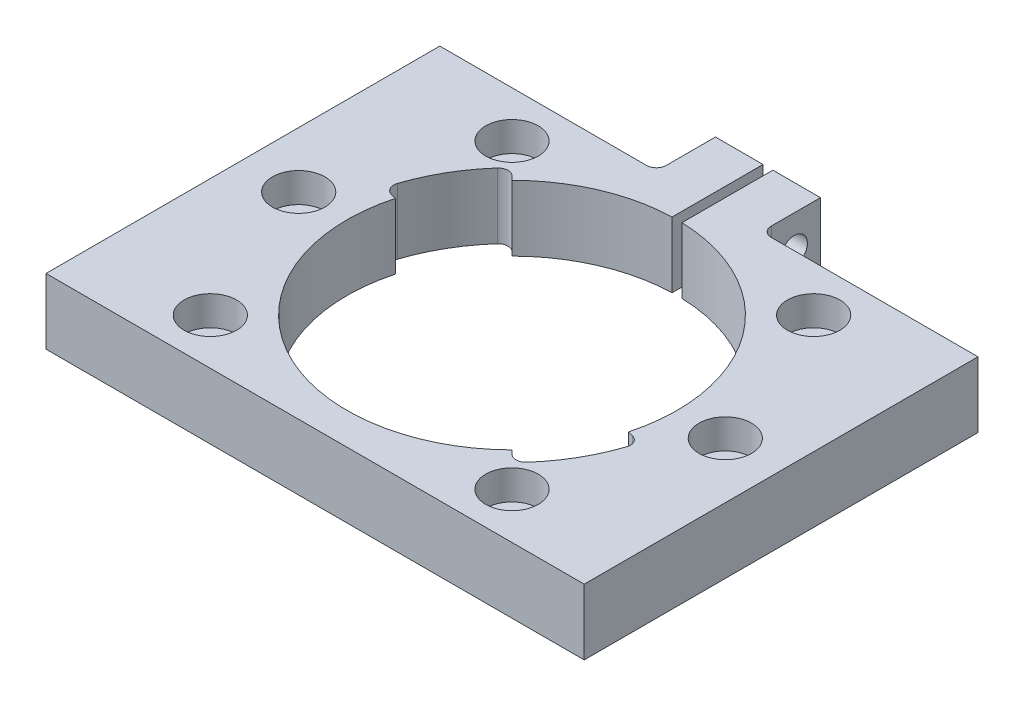
from build123d import *

# Parameters (mm, degrees)
SKETCH1_W           = 82
SKETCH1_H           = 60
SKETCH1_R           = 1.999999999
SKETCH1_R_2         = 2.000000001
SKETCH1_R_3         = 1.999999998
SKETCH1_R_4         = 2.000000002
BOSS_EXTRUDE1_DEPTH = 10
SKETCH2_W           = 16
SKETCH2_H           = 9
BOSS_EXTRUDE2_DEPTH = 10
SKETCH3_W           = 1.5
SKETCH3_H           = 14
CUT_EXTRUDE1_DEPTH  = 10
SKETCH4_R           = 2
CUT_EXTRUDE2_DEPTH  = 7.25
SKETCH5_R           = 1.6
CUT_EXTRUDE3_DEPTH  = 10
SKETCH7_R           = 4.000000002
SKETCH7_R_2         = 4.000000001
SKETCH7_R_3         = 4
SKETCH7_R_4         = 3.999999999
SKETCH7_R_5         = 3.999999998
CUT_EXTRUDE4_DEPTH  = 4.5
FILLET1_R           = 1.5


with BuildPart() as part:
    # Sketch1 → Boss-Extrude1 (new body)
    with BuildSketch(Plane(origin=(0, 76, 0), x_dir=(1, 0, 0), z_dir=(0, 1, 0))):
        Rectangle(SKETCH1_W, SKETCH1_H)
        with Locations(Location((-22.980970387, -22.98097039, 0), (0, 0, 270))):
            Circle(SKETCH1_R, mode=Mode.SUBTRACT)
        with Locations(Location((-32.5, -2e-09, 0), (0, 0, 270))):
            Circle(SKETCH1_R_2, mode=Mode.SUBTRACT)
        with Locations(Location((22.98097039, -22.980970387, 0), (0, 0, 270))):
            Circle(SKETCH1_R_3, mode=Mode.SUBTRACT)
        with BuildLine():
            ThreePointArc((-20.534900496, 18.291196287), (-19.458102274, 18.792869946), (-18.354154843, 18.354154843))
            Line((-18.354154843, 18.354154843), (-17.783735547, 17.783735547))
            ThreePointArc((-17.783735547, 17.783735547), (9.624488324, 23.235570243), (25.15, 0))
            ThreePointArc((25.15, 0), (24.934838264, -3.282733734), (24.293034531, -6.509298984))
            Line((24.293034531, -6.509298984), (25.072241781, -6.718086938))
            ThreePointArc((25.072241781, -6.718086938), (26.00415392, -7.454775906), (26.108090898, -8.638147351))
            ThreePointArc((26.108090898, -8.638147351), (23.815698604, -13.75), (20.534900496, -18.291196287))
            ThreePointArc((20.534900496, -18.291196287), (19.458102274, -18.792869946), (18.354154843, -18.354154843))
            Line((18.354154843, -18.354154843), (17.783735547, -17.783735547))
            ThreePointArc((17.783735547, -17.783735547), (-12.575, -21.780538905), (-24.293034531, 6.509298984))
            Line((-24.293034531, 6.509298984), (-25.072241781, 6.718086938))
            ThreePointArc((-25.072241781, 6.718086938), (-26.00415392, 7.454775906), (-26.108090898, 8.638147351))
            ThreePointArc((-26.108090898, 8.638147351), (-23.815698604, 13.75), (-20.534900496, 18.291196287))
        make_face(mode=Mode.SUBTRACT)
        with Locations(Location((-22.98097039, 22.980970387, 0), (0, 0, 270))):
            Circle(SKETCH1_R_4, mode=Mode.SUBTRACT)
        with Locations(Location((32.5, 2e-09, 0), (0, 0, 270))):
            Circle(SKETCH1_R, mode=Mode.SUBTRACT)
        with Locations(Location((22.980970387, 22.98097039, 0), (0, 0, 270))):
            Circle(SKETCH1_R_2, mode=Mode.SUBTRACT)
    extrude(amount=BOSS_EXTRUDE1_DEPTH)

    # Sketch2 → Boss-Extrude2 (add)
    with BuildSketch(Plane(origin=(0, 86, 0), x_dir=(1, 0, 0), z_dir=(0, 1, 0))):
        with Locations((0, 34.5)):
            Rectangle(SKETCH2_W, SKETCH2_H)
    extrude(amount=-BOSS_EXTRUDE2_DEPTH)

    # Sketch3 → Cut-Extrude1 (cut)
    with BuildSketch(Plane(origin=(0, 86, 0), x_dir=(1, 0, 0), z_dir=(0, 1, 0))):
        with Locations((0, 32)):
            Rectangle(SKETCH3_W, SKETCH3_H)
    extrude(amount=-CUT_EXTRUDE1_DEPTH, mode=Mode.SUBTRACT)

    # Sketch4 → Cut-Extrude2 (cut)
    with BuildSketch(Plane(origin=(8, 0, 0), x_dir=(0, 0, -1), z_dir=(1, 0, 0))):
        with Locations((35, 81)):
            Circle(SKETCH4_R)
    extrude(amount=-CUT_EXTRUDE2_DEPTH, mode=Mode.SUBTRACT)

    # Sketch5 → Cut-Extrude3 (cut)
    with BuildSketch(Plane(origin=(-0.75, 0, 0), x_dir=(0, 0, -1), z_dir=(1, 0, 0))):
        with Locations((35, 81)):
            Circle(SKETCH5_R)
    extrude(amount=-CUT_EXTRUDE3_DEPTH, mode=Mode.SUBTRACT)

    # Sketch7 → Cut-Extrude4 (cut)
    with BuildSketch(Plane(origin=(0, 86, 0), x_dir=(1, 0, 0), z_dir=(0, 1, 0))):
        with Locations(Location((-22.98097039, 22.980970387, 0), (0, 0, 270))):
            Circle(SKETCH7_R)
        with Locations(Location((22.980970387, 22.98097039, 0), (0, 0, 270))):
            Circle(SKETCH7_R_2)
        with Locations(Location((32.5, 0, 0), (0, 0, 270))):
            Circle(SKETCH7_R_3)
        with Locations(Location((-32.5, 0, 0), (0, 0, 270))):
            Circle(SKETCH7_R_3)
        with Locations(Location((-22.980970387, -22.98097039, 0), (0, 0, 270))):
            Circle(SKETCH7_R_4)
        with Locations(Location((22.98097039, -22.980970387, 0), (0, 0, 270))):
            Circle(SKETCH7_R_5)
    extrude(amount=-CUT_EXTRUDE4_DEPTH, mode=Mode.SUBTRACT)

    # Fillet1
    fillet1_edges = [part.edges().sort_by_distance(p)[0] for p in [
        (8, 81, -30),
        (-8, 81, -30),
    ]]
    fillet(fillet1_edges, radius=FILLET1_R)


solid = part.part
